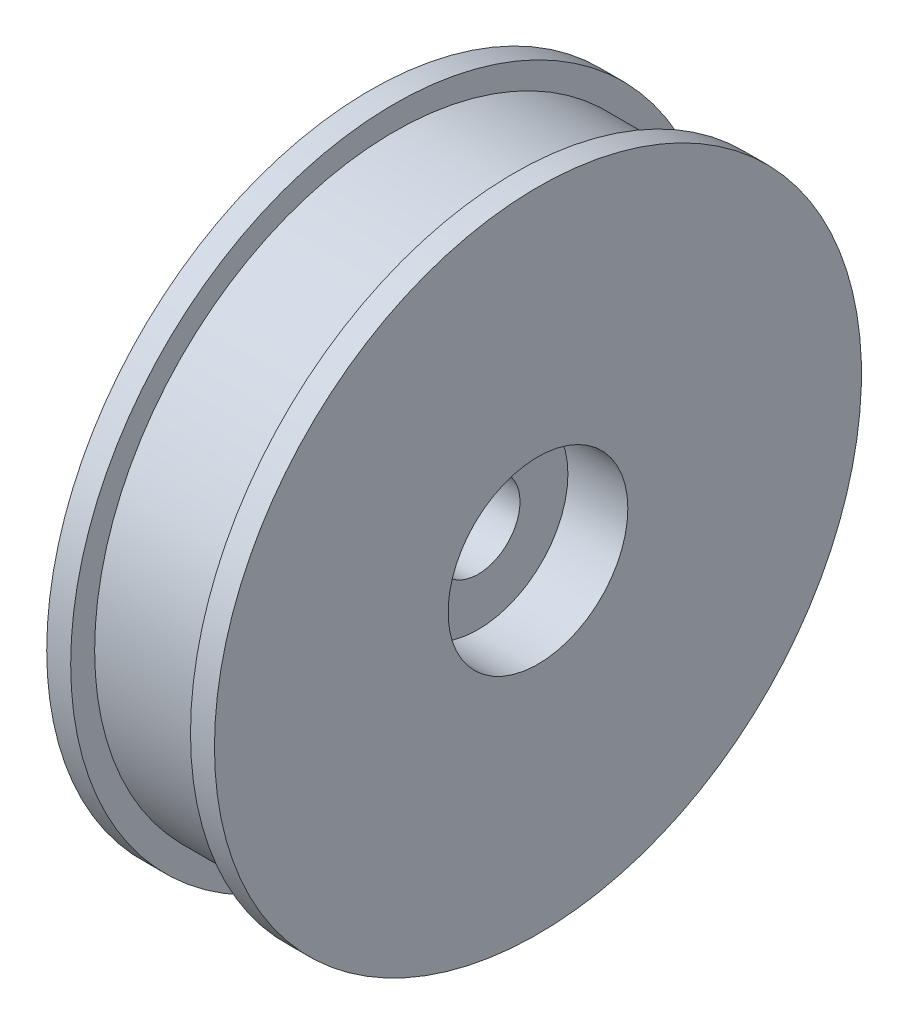
from build123d import *

# Parameters (mm, degrees)
CUT_EXTRUDE1_DEPTH      = 40.347808071
CUT_EXTRUDE1_DEPTH_BACK = 40.347808071
SKETCH2_R               = 3.5
SKETCH3_R               = 7.5
CUT_EXTRUDE2_DEPTH      = 5


with BuildPart() as part:
    # Sketch1 → Revolve1 (revolve)
    with BuildSketch(Plane.XY, mode=Mode.PRIVATE) as revolve1_sk:
        Polygon((-9.5, 0), (9.5, 0), (9.5, 27), (7.5, 27), (7.5, 25), (-2.5, 25), (-2.5, 27), (-4.5, 27), (-4.5, 5), (-9.5, 5), align=None)
    revolve(revolve1_sk.sketch.rotate(Axis((-9.5, 0, 0), (1, 0, 0)), 90), axis=Axis((-9.5, 0, 0), (1, 0, 0)))

    # Sketch2 → Cut-Extrude1 (cut, two sides: drawn at the far end of the back side and taken through both)
    with BuildSketch(Plane(origin=(0, 0, 0), x_dir=(0, 0, -1), z_dir=(1, 0, 0)).offset(-CUT_EXTRUDE1_DEPTH_BACK)):
        Circle(SKETCH2_R)
    extrude(amount=CUT_EXTRUDE1_DEPTH + CUT_EXTRUDE1_DEPTH_BACK, mode=Mode.SUBTRACT)

    # Sketch3 → Cut-Extrude2 (cut)
    with BuildSketch(Plane(origin=(9.5, 0, 0), x_dir=(0, 0, -1), z_dir=(1, 0, 0))):
        Circle(SKETCH3_R)
    extrude(amount=-CUT_EXTRUDE2_DEPTH, mode=Mode.SUBTRACT)


solid = part.part
